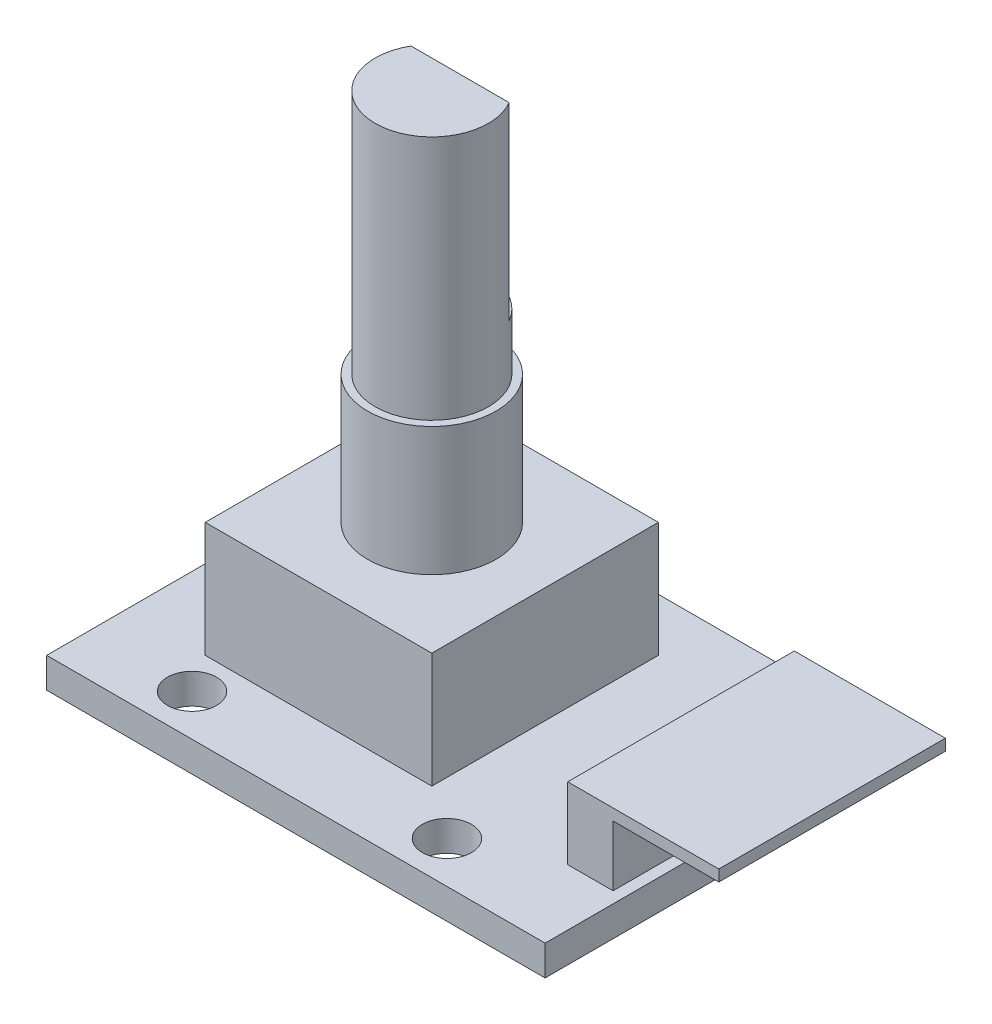
from build123d import *

# Parameters (mm, degrees)
SKETCH2_W           = 26.4
SKETCH2_H           = 19
BOSS_EXTRUDE1_DEPTH = 1.6
SKETCH3_R           = 1.3
CUT_EXTRUDE1_DEPTH  = 33.56562605
SKETCH4_W           = 12
SKETCH4_H           = 12
BOSS_EXTRUDE2_DEPTH = 6.1
SKETCH5_R           = 3.4
BOSS_EXTRUDE3_DEPTH = 6.8
SKETCH6_R           = 3
BOSS_EXTRUDE4_DEPTH = 3
BOSS_EXTRUDE5_DEPTH = 10
SKETCH8_W           = 3
SKETCH8_H           = 12
SKETCH8_W_2         = 5
BOSS_EXTRUDE6_DEPTH = 3.8
SKETCH9_W           = 5.6
SKETCH9_H           = 3.2
CUT_EXTRUDE2_DEPTH  = 45.286002303


with BuildPart() as part:
    # Sketch2 → Boss-Extrude1 (new body)
    with BuildSketch(Plane(origin=(0, 0, 0), x_dir=(1, 0, 0), z_dir=(0, 1, 0))):
        with Locations((13.2, 9.5)):
            Rectangle(SKETCH2_W, SKETCH2_H)
    extrude(amount=BOSS_EXTRUDE1_DEPTH)

    # Sketch3 → Cut-Extrude1 (cut, through all)
    with BuildSketch(Plane(origin=(0, 1.6, 0), x_dir=(1, 0, 0), z_dir=(0, 1, 0))):
        with Locations(Location((5.5, 2.2, 0), (0, 0, 270))):
            Circle(SKETCH3_R)
        with Locations(Location((19, 2.2, 0), (0, 0, 270))):
            Circle(SKETCH3_R)
    extrude(amount=-CUT_EXTRUDE1_DEPTH, mode=Mode.SUBTRACT)

    # Sketch4 → Boss-Extrude2 (add)
    with BuildSketch(Plane(origin=(0, 1.6, 0), x_dir=(1, 0, 0), z_dir=(0, 1, 0))):
        with Locations((10.2, 10.2)):
            Rectangle(SKETCH4_W, SKETCH4_H)
    extrude(amount=BOSS_EXTRUDE2_DEPTH)

    # Sketch5 → Boss-Extrude3 (add)
    with BuildSketch(Plane(origin=(0, 7.7, 0), x_dir=(1, 0, 0), z_dir=(0, 1, 0))):
        with Locations(Location((10.2, 10.2, 0), (0, 0, 270))):
            Circle(SKETCH5_R)
    extrude(amount=BOSS_EXTRUDE3_DEPTH)

    # Sketch6 → Boss-Extrude4 (add)
    with BuildSketch(Plane(origin=(0, 14.5, 0), x_dir=(1, 0, 0), z_dir=(0, 1, 0))):
        with Locations(Location((10.2, 10.2, 0), (0, 0, 270))):
            Circle(SKETCH6_R)
    extrude(amount=BOSS_EXTRUDE4_DEPTH)

    # Sketch7 → Boss-Extrude5 (add)
    with BuildSketch(Plane(origin=(0, 17.5, 0), x_dir=(1, 0, 0), z_dir=(0, 1, 0))):
        with BuildLine():
            ThreePointArc((13.2, 10.2), (13.097777479, 10.976457135), (12.798076211, 11.7))
            Line((12.798076211, 11.7), (12.798076211, 8.7))
            ThreePointArc((12.798076211, 8.7), (13.097777479, 9.423542865), (13.2, 10.2))
        make_face()
        with BuildLine():
            Line((7.601923789, 8.7), (7.601923789, 11.7))
            ThreePointArc((7.601923789, 11.7), (7.2, 10.2), (7.601923789, 8.7))
        make_face()
        with BuildLine():
            Line((12.798076211, 11.7), (7.601923789, 11.7))
            Line((7.601923789, 11.7), (7.601923789, 8.7))
            ThreePointArc((7.601923789, 8.7), (8.7, 7.601923789), (10.2, 7.2))
            ThreePointArc((10.2, 7.2), (11.7, 7.601923789), (12.798076211, 8.7))
            Line((12.798076211, 8.7), (12.798076211, 11.7))
        make_face()
    extrude(amount=BOSS_EXTRUDE5_DEPTH)

    # Sketch8 → Boss-Extrude6 (add)
    with BuildSketch(Plane(origin=(0, 1.6, 0), x_dir=(1, 0, 0), z_dir=(0, 1, 0))):
        with Locations((24.9, 10.2)):
            Rectangle(SKETCH8_W, SKETCH8_H)
        with Locations((28.9, 10.2)):
            Rectangle(SKETCH8_W_2, SKETCH8_H)
    extrude(amount=BOSS_EXTRUDE6_DEPTH)

    # Sketch9 → Cut-Extrude2 (cut, through all)
    with BuildSketch(Plane.XY.offset(-4.2)):
        with Locations((28.6, 3.2)):
            Rectangle(SKETCH9_W, SKETCH9_H)
    extrude(amount=-CUT_EXTRUDE2_DEPTH, mode=Mode.SUBTRACT)


solid = part.part
